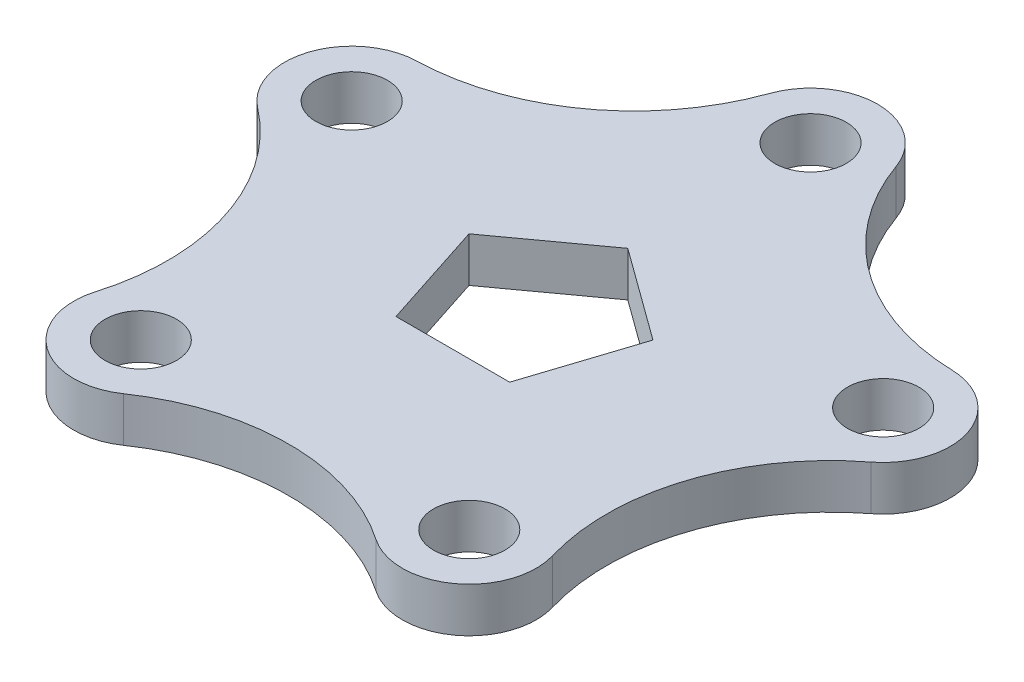
from build123d import *

# Parameters (mm, degrees)
SKETCH1_R           = 15
SKETCH1_R_2         = 8
BOSS_EXTRUDE1_DEPTH = 10


with BuildPart() as part:
    # Sketch1 → Boss-Extrude1 (new body)
    # profile 1 of 6: a face of its own
    with BuildSketch(Plane(origin=(0, 0, 0), x_dir=(1, 0, 0), z_dir=(0, 1, 0))):
        with BuildLine():
            ThreePointArc((14.132148934, 67.528157367), (14.781445024, 65.051251261), (15, 62.5))
            ThreePointArc((15, 62.5), (-2.551251261, 47.718554976), (-14.132148934, 67.528157367))
            ThreePointArc((-14.132148934, 67.528157367), (-31.850049433, 43.837832205), (-59.85601991, 34.307820558))
            ThreePointArc((-59.85601991, 34.307820558), (-48.982179908, 30.065883168), (-44.441032268, 19.313562148))
            ThreePointArc((-44.441032268, 19.313562148), (-52.816722502, 5.855534056), (-68.590168285, 7.426875892))
            ThreePointArc((-68.590168285, 7.426875892), (-51.534462525, -16.744561909), (-51.125203669, -46.324758182))
            ThreePointArc((-51.125203669, -46.324758182), (-34.595244691, -35.717192541), (-21.736578268, -50.563562148))
            ThreePointArc((-21.736578268, -50.563562148), (-23.466968654, -57.557663999), (-28.25890636, -62.938095635))
            ThreePointArc((-28.25890636, -62.938095635), (0, -54.186540592), (28.25890636, -62.938095635))
            ThreePointArc((28.25890636, -62.938095635), (27.919799484, -38.428307233), (51.125203669, -46.324758182))
            ThreePointArc((51.125203669, -46.324758182), (51.534462525, -16.744561909), (68.590168285, 7.426875892))
            ThreePointArc((68.590168285, 7.426875892), (45.175184524, 14.678307233), (59.85601991, 34.307820558))
            ThreePointArc((59.85601991, 34.307820558), (31.850049433, 43.837832205), (14.132148934, 67.528157367))
        make_face()
        Polygon((-20.57248383, 6.684405197), (0, 21.631189606), (20.57248383, 6.684405197), (12.71449424, -17.5), (-12.71449424, -17.5), align=None, mode=Mode.SUBTRACT)
    # profile 2 of 6: a face of its own
    with BuildSketch(Plane(origin=(0, 0, 0), x_dir=(1, 0, 0), z_dir=(0, 1, 0))):
        with Locations((-36.736578268, -50.563562148)):
            Circle(SKETCH1_R)
        with Locations(Location((-36.736578268, -50.563562148, 0), (0, 0, 270))):
            Circle(SKETCH1_R_2, mode=Mode.SUBTRACT)
    # profile 3 of 6: a face of its own
    with BuildSketch(Plane(origin=(0, 0, 0), x_dir=(1, 0, 0), z_dir=(0, 1, 0))):
        with Locations((36.736578268, -50.563562148)):
            Circle(SKETCH1_R)
        with Locations(Location((36.736578268, -50.563562148, 0), (0, 0, 270))):
            Circle(SKETCH1_R_2, mode=Mode.SUBTRACT)
    # profile 4 of 6: a face of its own
    with BuildSketch(Plane(origin=(0, 0, 0), x_dir=(1, 0, 0), z_dir=(0, 1, 0))):
        with Locations((59.441032268, 19.313562148)):
            Circle(SKETCH1_R)
        with Locations(Location((59.441032268, 19.313562148, 0), (0, 0, 270))):
            Circle(SKETCH1_R_2, mode=Mode.SUBTRACT)
    # profile 5 of 6: a face of its own
    with BuildSketch(Plane(origin=(0, 0, 0), x_dir=(1, 0, 0), z_dir=(0, 1, 0))):
        with Locations((0, 62.5)):
            Circle(SKETCH1_R)
        with Locations(Location((0, 62.5, 0), (0, 0, 270))):
            Circle(SKETCH1_R_2, mode=Mode.SUBTRACT)
    # profile 6 of 6: a face of its own
    with BuildSketch(Plane(origin=(0, 0, 0), x_dir=(1, 0, 0), z_dir=(0, 1, 0))):
        with Locations((-59.441032268, 19.313562148)):
            Circle(SKETCH1_R)
        with Locations(Location((-59.441032268, 19.313562148, 0), (0, 0, 270))):
            Circle(SKETCH1_R_2, mode=Mode.SUBTRACT)
    extrude(amount=BOSS_EXTRUDE1_DEPTH)


solid = part.part
